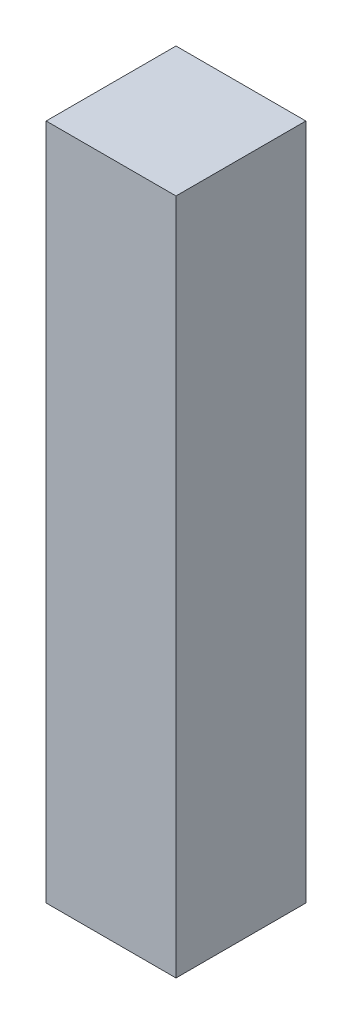
from build123d import *

# Parameters (mm, degrees)
SKETCH1_W           = 7.9
SKETCH1_H           = 7.9
BOSS_EXTRUDE1_DEPTH = 41.2


with BuildPart() as part:
    # Sketch1 → Boss-Extrude1 (new body)
    with BuildSketch(Plane(origin=(0, 0, 0), x_dir=(1, 0, 0), z_dir=(0, 1, 0))):
        with Locations((3.95, 3.95)):
            Rectangle(SKETCH1_W, SKETCH1_H)
    extrude(amount=BOSS_EXTRUDE1_DEPTH)


solid = part.part
